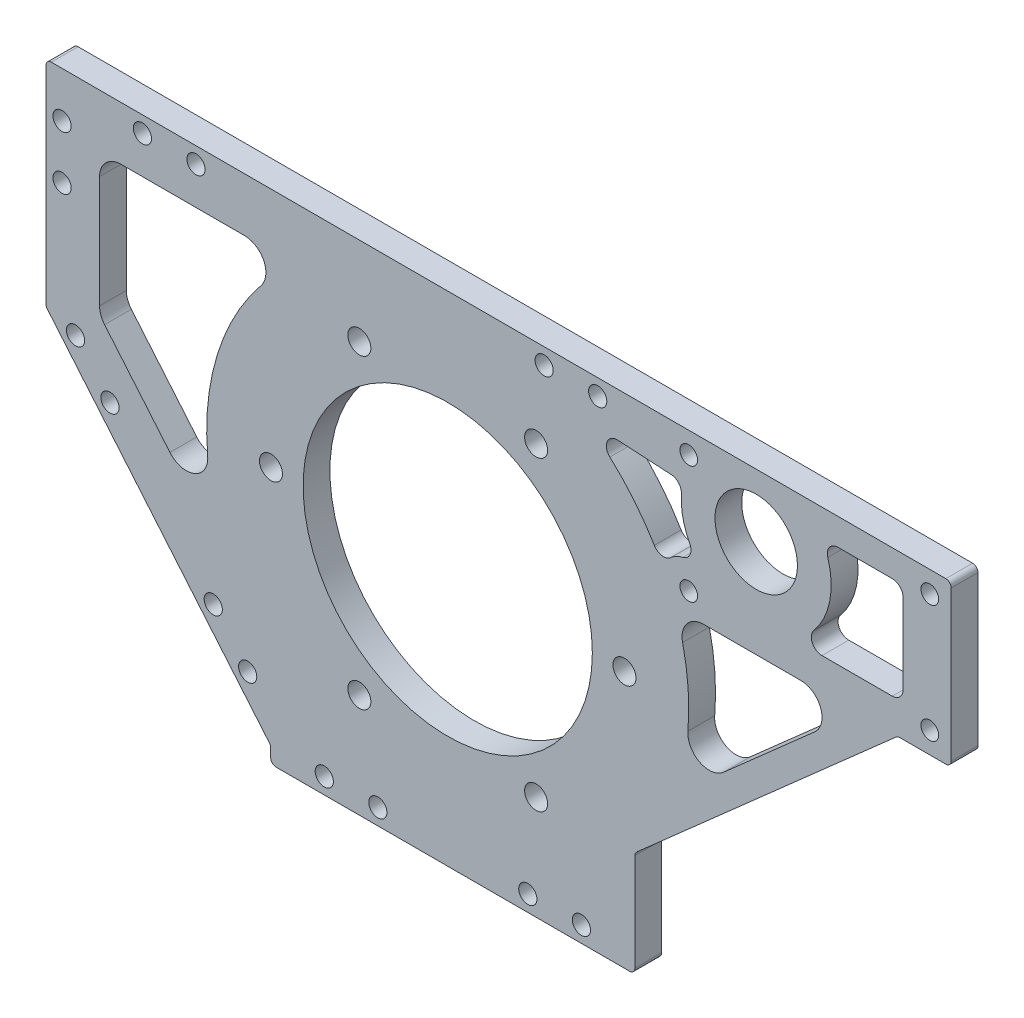
from build123d import *

# Parameters (mm, degrees)
SKETCH_1_W           = 150
SKETCH_1_H           = 90
EXTRUDE_1_DEPTH      = 5
SKETCH_3_R           = 27
CUT_EXTRUDE_1_DEPTH  = 5
SKETCH_4_R           = 2.15
CUT_EXTRUDE_2_DEPTH  = 88.60707734
SKETCH_5_R           = 7.7
CUT_EXTRUDE_3_DEPTH  = 88.60707734
CHAMFER_1_SIZE       = 40
CHAMFER_3_SIZE       = 50
CHAMFER_3_SIZE2      = 41.954981559
CUT_EXTRUDE_4_DEPTH  = 88.60707734
SKETCH_7_W           = 19
SKETCH_7_H           = 30
EXTRUDE_2_DEPTH      = 5
CHAMFER_2_SIZE       = 10
SKETCH_8_R           = 1.65
CUT_EXTRUDE_5_DEPTH  = 105.335995706
SKETCH_10_R          = 1.7
CUT_EXTRUDE_6_DEPTH  = 105.335995706
SKETCH_11_R          = 1.7
CUT_EXTRUDE_7_DEPTH  = 105.335995706
CUT_EXTRUDE_9_DEPTH  = 105.335995706
EXTRUDE_1_2_DEPTH    = 5
CUT_EXTRUDE_10_DEPTH = 105.335995706
FILLET_1_R           = 2
FILLET_2_R           = 4
SKETCH_16_W          = 68
SKETCH_16_H          = 5
EXTRUDE_3_DEPTH      = 3
EXTRUDE_4_DEPTH      = 5
FILLET_3_R           = 1
SKETCH_18_R          = 1.7
CUT_EXTRUDE_11_DEPTH = 106.664563735


with BuildPart() as part:
    # 草图1 → Extrude 1 (new body)
    with BuildSketch(Plane.XY):
        Rectangle(SKETCH_1_W, SKETCH_1_H)
    extrude(amount=EXTRUDE_1_DEPTH)

    # 草图3 → 切除-拉伸1 (cut)
    with BuildSketch(Plane.XY.offset(5)):
        Circle(SKETCH_3_R)
    extrude(amount=-CUT_EXTRUDE_1_DEPTH, mode=Mode.SUBTRACT)

    # 草图4 → 切除-拉伸2 (cut, through all)
    with BuildSketch(Plane.XY.offset(5)):
        with Locations((16.5, 28.578838325)):
            Circle(SKETCH_4_R)
        with Locations((33, 0)):
            Circle(SKETCH_4_R)
        with Locations((16.5, -28.578838325)):
            Circle(SKETCH_4_R)
        with Locations((-16.5, -28.578838325)):
            Circle(SKETCH_4_R)
        with Locations((-33, 0)):
            Circle(SKETCH_4_R)
        with Locations((-16.5, 28.578838325)):
            Circle(SKETCH_4_R)
    extrude(amount=-CUT_EXTRUDE_2_DEPTH, mode=Mode.SUBTRACT)

    # 草图5 → 切除-拉伸3 (cut, through all)
    with BuildSketch(Plane.XY.offset(5)):
        with Locations((57.590256339, 33.24975)):
            Circle(SKETCH_5_R)
    extrude(amount=-CUT_EXTRUDE_3_DEPTH, mode=Mode.SUBTRACT)

    # 倒角1
    chamfer_1_edges = [part.edges().sort_by_distance(p)[0] for p in [
        (75, -45, 2.5),
    ]]
    chamfer(chamfer_1_edges, length=CHAMFER_1_SIZE)

    # 倒角3
    chamfer_3_edges = [part.edges().sort_by_distance(p)[0] for p in [
        (-75, -45, 2.5),
    ]]
    chamfer_3_side = [part.faces().sort_by_distance(p)[0] for p in [
        (-75, 0, 2.5),
    ]]
    chamfer(chamfer_3_edges, length=CHAMFER_3_SIZE, length2=CHAMFER_3_SIZE2, reference=chamfer_3_side[0])

    # 草图6 → 切除-拉伸4 (cut, through all)
    with BuildSketch(Plane(origin=(0, 0, 0), x_dir=(-1, 0, 0), z_dir=(0, 0, -1))):
        Polygon((-39.037333413, -40.962666587), (-35, -40.962666587), (-35, -45), align=None)
        Polygon((36.432743419, -40.962666587), (33.045018441, -40.962666587), (33.045018441, -45), align=None)
    extrude(amount=-CUT_EXTRUDE_4_DEPTH, mode=Mode.SUBTRACT)

    # 草图7 → 凸台-拉伸2 (add, through all)
    with BuildSketch(Plane.XY.offset(5)):
        with Locations((84.5, 30)):
            Rectangle(SKETCH_7_W, SKETCH_7_H)
    extrude(amount=-EXTRUDE_2_DEPTH)

    # 倒角2
    chamfer_2_edges = [part.edges().sort_by_distance(p)[0] for p in [
        (75, 15, 2.5),
    ]]
    chamfer(chamfer_2_edges, length=CHAMFER_2_SIZE)

    # 草图8 → 切除-拉伸5 (cut, through all)
    with BuildSketch(Plane.XY.offset(5)):
        with Locations((90, 19)):
            Circle(SKETCH_8_R)
        with Locations((90, 41)):
            Circle(SKETCH_8_R)
        with Locations((45, 41)):
            Circle(SKETCH_8_R)
        with Locations((45, 19)):
            Circle(SKETCH_8_R)
    extrude(amount=-CUT_EXTRUDE_5_DEPTH, mode=Mode.SUBTRACT)

    # 草图10 → 切除-拉伸6 (cut, through all)
    with BuildSketch(Plane.XY.offset(5)):
        with Locations((-37.348548138, -35.204081542)):
            Circle(SKETCH_10_R)
        with Locations((-43.776424235, -27.543637111)):
            Circle(SKETCH_10_R)
        with Locations((-72, 36.5)):
            Circle(SKETCH_10_R)
        with Locations((-72, 26.5)):
            Circle(SKETCH_10_R)
        with Locations((-69.487928622, 3.098140613)):
            Circle(SKETCH_10_R)
        with Locations((-63.060052525, -4.562303818)):
            Circle(SKETCH_10_R)
    extrude(amount=-CUT_EXTRUDE_6_DEPTH, mode=Mode.SUBTRACT)

    # 草图11 → 切除-拉伸7 (cut, through all)
    with BuildSketch(Plane.XY.offset(5)):
        with Locations((-47, 42)):
            Circle(SKETCH_11_R)
        with Locations((-57, 42)):
            Circle(SKETCH_11_R)
        with Locations((18, 42)):
            Circle(SKETCH_11_R)
        with Locations((28, 42)):
            Circle(SKETCH_11_R)
    extrude(amount=-CUT_EXTRUDE_7_DEPTH, mode=Mode.SUBTRACT)

    # 草图13 → 切除-拉伸9 (cut, through all)
    with BuildSketch(Plane.XY.offset(5)):
        with BuildLine():
            Line((-65, 35), (-65, 8.639702343))
            Line((-65, 8.639702343), (-39.185066827, -22.125337008))
            ThreePointArc((-39.185066827, -22.125337008), (-44.202419924, 8.434813149), (-28.284271247, 35))
            Line((-28.284271247, 35), (-65, 35))
        make_face()
        with BuildLine():
            Line((34.954981559, -28.339888218), (34.954981559, -45))
            Line((34.954981559, -45), (35, -45))
            Line((35, -45), (85, -3.384776311))
            Line((85, -3.384776311), (85, 15))
            Line((85, 15), (42.426406871, 15))
            ThreePointArc((42.426406871, 15), (44.345871246, -7.644848165), (34.954981559, -28.339888218))
        make_face()
    extrude(amount=-CUT_EXTRUDE_9_DEPTH, mode=Mode.SUBTRACT)

    # 草图14 → Extrude 1 2 (add, through all)
    with BuildSketch(Plane.XY.offset(5)):
        Polygon((34.954981559, -28.339888218), (84, 15), (80.689106292, 18.746729621), (31.644087851, -24.593158597), align=None)
    extrude(amount=-EXTRUDE_1_2_DEPTH)

    # 草图15 → 切除-拉伸10 (cut, through all)
    with BuildSketch(Plane.XY.offset(5)):
        with BuildLine():
            Line((64.368429023, 21), (85, 21))
            Line((85, 21), (85, 40))
            Line((85, 40), (69.855415324, 40))
            ThreePointArc((69.855415324, 40), (71.040613965, 29.365437998), (64.368429023, 21))
        make_face()
        with BuildLine():
            Line((25.403039136, 37.144119355), (43.874708376, 36.057550576))
            ThreePointArc((43.874708376, 36.057550576), (44.31250452, 28.811134605), (48.320539762, 22.758212716))
            ThreePointArc((48.320539762, 22.758212716), (43.557063519, 23.802924259), (40.158036561, 20.305962168))
            ThreePointArc((40.158036561, 20.305962168), (33.844416763, 29.657300181), (25.403039136, 37.144119355))
        make_face()
    extrude(amount=-CUT_EXTRUDE_10_DEPTH, mode=Mode.SUBTRACT)

    # 圆角1
    fillet_1_edges = [part.edges().sort_by_distance(p)[0] for p in [
        (64.368429023, 21, 2.5),
        (69.855415324, 40, 2.5),
        (85, 40, 2.5),
        (85, 21, 2.5),
        (40.158036561, 20.305962168, 2.5),
        (25.403039136, 37.144119355, 2.5),
        (43.874708376, 36.057550576, 2.5),
        (48.320539762, 22.758212716, 2.5),
    ]]
    fillet(fillet_1_edges, radius=FILLET_1_R)

    # 圆角2
    fillet_2_edges = [part.edges().sort_by_distance(p)[0] for p in [
        (-65, 35, 2.5),
        (-28.284271247, 35, 2.5),
        (-39.185066827, -22.125337008, 2.5),
        (-65, 8.639702343, 2.5),
        (42.426406871, 15, 2.5),
        (42.392765926, -15.094813585, 2.5),
        (76.449168652, 15, 2.5),
    ]]
    fillet(fillet_2_edges, radius=FILLET_2_R)

    # 草图16 → 凸台-拉伸3 (add)
    with BuildSketch(Plane.XZ.offset(45)):
        with Locations((0.954981559, 2.5)):
            Rectangle(SKETCH_16_W, SKETCH_16_H)
    extrude(amount=EXTRUDE_3_DEPTH)

    # 草图17 → 凸台-拉伸4 (add, through all)
    with BuildSketch(Plane.XY.offset(5)):
        Polygon((-36.432743419, -40.962666587), (-33.045018441, -45), (-33.045018441, -40.962666587), align=None)
    extrude(amount=-EXTRUDE_4_DEPTH)

    # 圆角3
    fillet_3_edges = [part.edges().sort_by_distance(p)[0] for p in [
        (34.954981559, -28.339888218, 2.5),
        (84, 15, 2.5),
        (34.954981559, -48, 2.5),
        (-33.045018441, -48, 2.5),
        (-33.045018441, -45, 2.5),
        (-75, 5, 2.5),
        (-75, 45, 2.5),
        (94, 45, 2.5),
        (94, 15, 2.5),
    ]]
    fillet(fillet_3_edges, radius=FILLET_3_R)

    # 草图18 → 切除-拉伸11 (cut, through all)
    with BuildSketch(Plane.XY.offset(5)):
        with Locations((24.954981559, -45)):
            Circle(SKETCH_18_R)
        with Locations((14.954981559, -45)):
            Circle(SKETCH_18_R)
        with Locations((-13.045018441, -45)):
            Circle(SKETCH_18_R)
        with Locations((-23.045018441, -45)):
            Circle(SKETCH_18_R)
    extrude(amount=-CUT_EXTRUDE_11_DEPTH, mode=Mode.SUBTRACT)


solid = part.part
